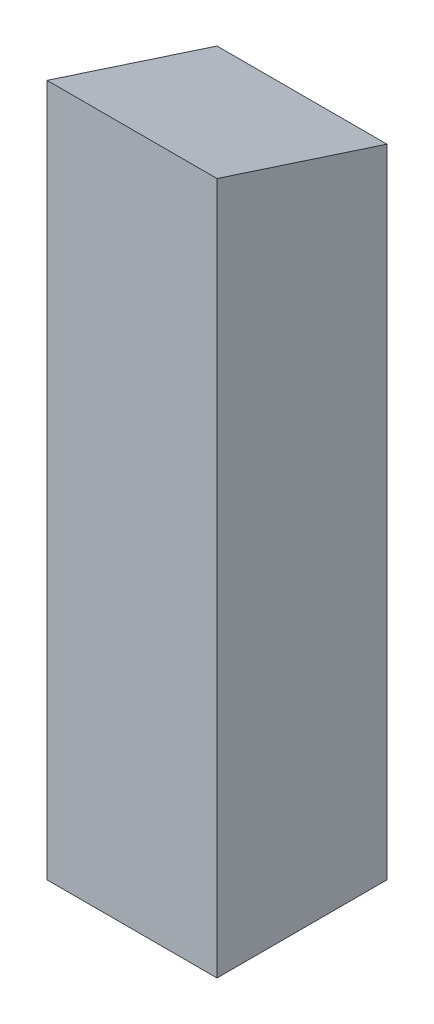
from build123d import *

# Parameters (mm, degrees)
SKETCH1_W           = 19.05
SKETCH1_H           = 68.2117
SKETCH1_H_2         = 3.175
BOSS_EXTRUDE1_DEPTH = 19.05


with BuildPart() as part:
    # Sketch1 → Boss-Extrude1 (new body)
    with BuildSketch(Plane(origin=(0, 0, 0), x_dir=(0, 0, -1), z_dir=(1, 0, 0))):
        Polygon((0, 68.2117), (0, 74.401420213), (19.05, 68.2117), align=None)
        with Locations((9.525, 34.10585)):
            Rectangle(SKETCH1_W, SKETCH1_H)
        with Locations((9.525, -1.5875)):
            Rectangle(SKETCH1_W, SKETCH1_H_2)
    extrude(amount=BOSS_EXTRUDE1_DEPTH)


solid = part.part
